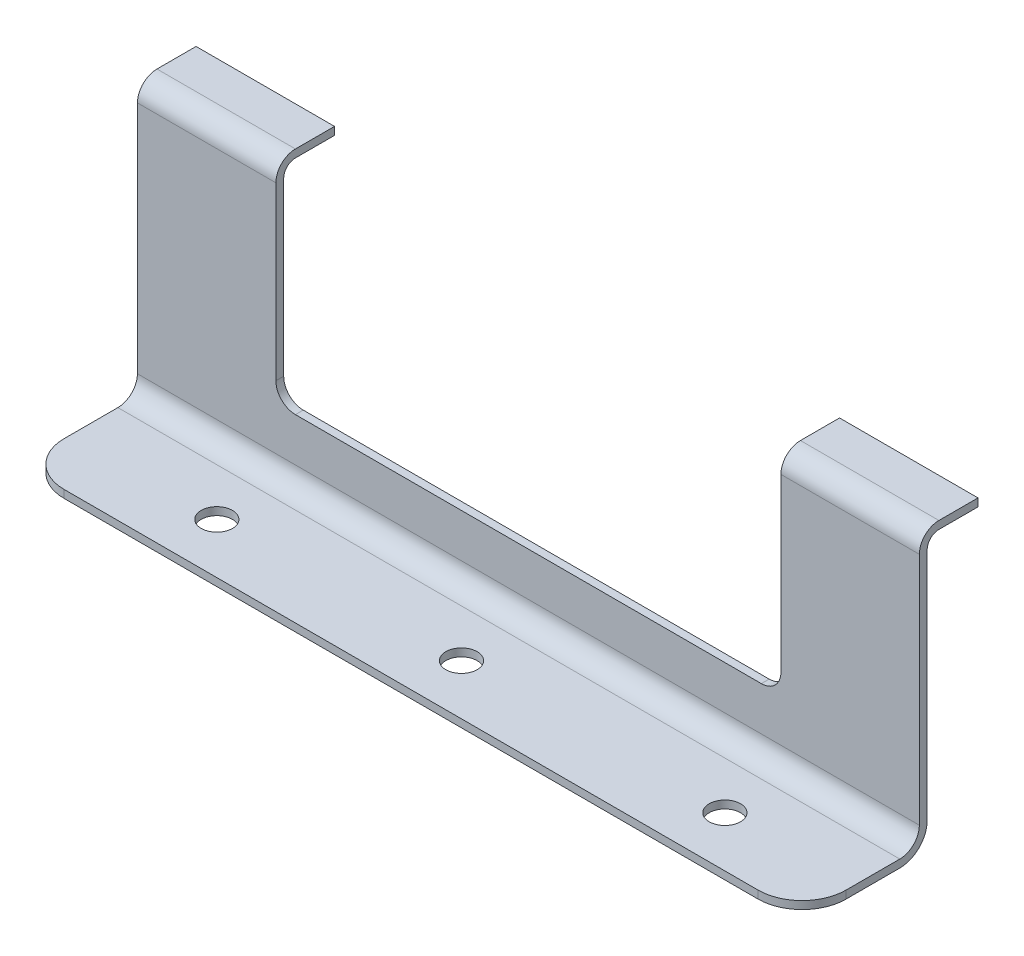
from build123d import *

# Parameters (mm, degrees)
BOSS_EXTRUDE1_DEPTH = 100
SKETCH2_R           = 4
CUT_EXTRUDE1_DEPTH  = 200
CUT_EXTRUDE2_DEPTH  = 200
SCALE1_SCALE        = 2


with BuildPart() as part:
    # Sketch1 → Boss-Extrude1 (new, symmetric)
    with BuildSketch(Plane(origin=(0, 0, 0), x_dir=(0, 0, -1), z_dir=(1, 0, 0))):
        with BuildLine():
            Line((4.403376918, 32.272727273), (-5.596623082, 32.272727273))
            ThreePointArc((-5.596623082, 32.272727273), (-9.132156988, 30.808261179), (-10.596623082, 27.272727273))
            Line((-10.596623082, 27.272727273), (-10.596623082, -32.727272727))
            ThreePointArc((-10.596623082, -32.727272727), (-12.061089177, -36.262806633), (-15.596623082, -37.727272727))
            Line((-15.596623082, -37.727272727), (-40.596623082, -37.727272727))
            Line((-40.596623082, -37.727272727), (-40.596623082, -39.727272727))
            Line((-40.596623082, -39.727272727), (-15.596623082, -39.727272727))
            ThreePointArc((-15.596623082, -39.727272727), (-10.646875614, -37.677020196), (-8.596623082, -32.727272727))
            Line((-8.596623082, -32.727272727), (-8.596623082, 27.272727273))
            ThreePointArc((-8.596623082, 27.272727273), (-7.717943426, 29.394047616), (-5.596623082, 30.272727273))
            Line((-5.596623082, 30.272727273), (4.403376918, 30.272727273))
            Line((4.403376918, 30.272727273), (4.403376918, 32.272727273))
        make_face()
    extrude(amount=BOSS_EXTRUDE1_DEPTH, both=True)

    # Sketch2 → Cut-Extrude1 (cut)
    with BuildSketch(Plane(origin=(0, 32.272727273, 0), x_dir=(1, 0, 0), z_dir=(0, 1, 0))):
        with Locations(Location((0, -27.707416892, 0), (0, 0, 270))):
            Circle(SKETCH2_R)
        with Locations(Location((-62.576946362, -27.707416892, 0), (0, 0, 270))):
            Circle(SKETCH2_R)
        with Locations(Location((67.371990144, -27.707416892, 0), (0, 0, 270))):
            Circle(SKETCH2_R)
        with BuildLine():
            Line((-88.753028946, -40.596623082), (-100, -40.596623082))
            Line((-100, -40.596623082), (-100, -29.349652028))
            ThreePointArc((-100, -29.349652028), (-96.705838446, -37.302461529), (-88.753028946, -40.596623082))
        make_face()
        with BuildLine():
            Line((100, -40.596623082), (100, -29.349652028))
            ThreePointArc((100, -29.349652028), (96.705838446, -37.302461529), (88.753028946, -40.596623082))
            Line((88.753028946, -40.596623082), (100, -40.596623082))
        make_face()
    extrude(amount=-CUT_EXTRUDE1_DEPTH, mode=Mode.SUBTRACT)

    # Sketch3 → Cut-Extrude2 (cut)
    with BuildSketch(Plane.XY.offset(10.596623082)):
        with BuildLine():
            Line((-64.584534402, 178.454407754), (64.584534402, 178.454407754))
            Line((64.584534402, 178.454407754), (64.584534402, -16.573121652))
            ThreePointArc((64.584534402, -16.573121652), (63.120068308, -20.108655558), (59.584534402, -21.573121652))
            Line((59.584534402, -21.573121652), (-59.584534402, -21.573121652))
            ThreePointArc((-59.584534402, -21.573121652), (-63.120068308, -20.108655558), (-64.584534402, -16.573121652))
            Line((-64.584534402, -16.573121652), (-64.584534402, 178.454407754))
        make_face()
    extrude(amount=-CUT_EXTRUDE2_DEPTH, mode=Mode.SUBTRACT)


with BuildPart() as part_1:
    # Scale1: scaled about (0, 0, 0)
    add(part.part.scale(SCALE1_SCALE))


solid = part_1.part
